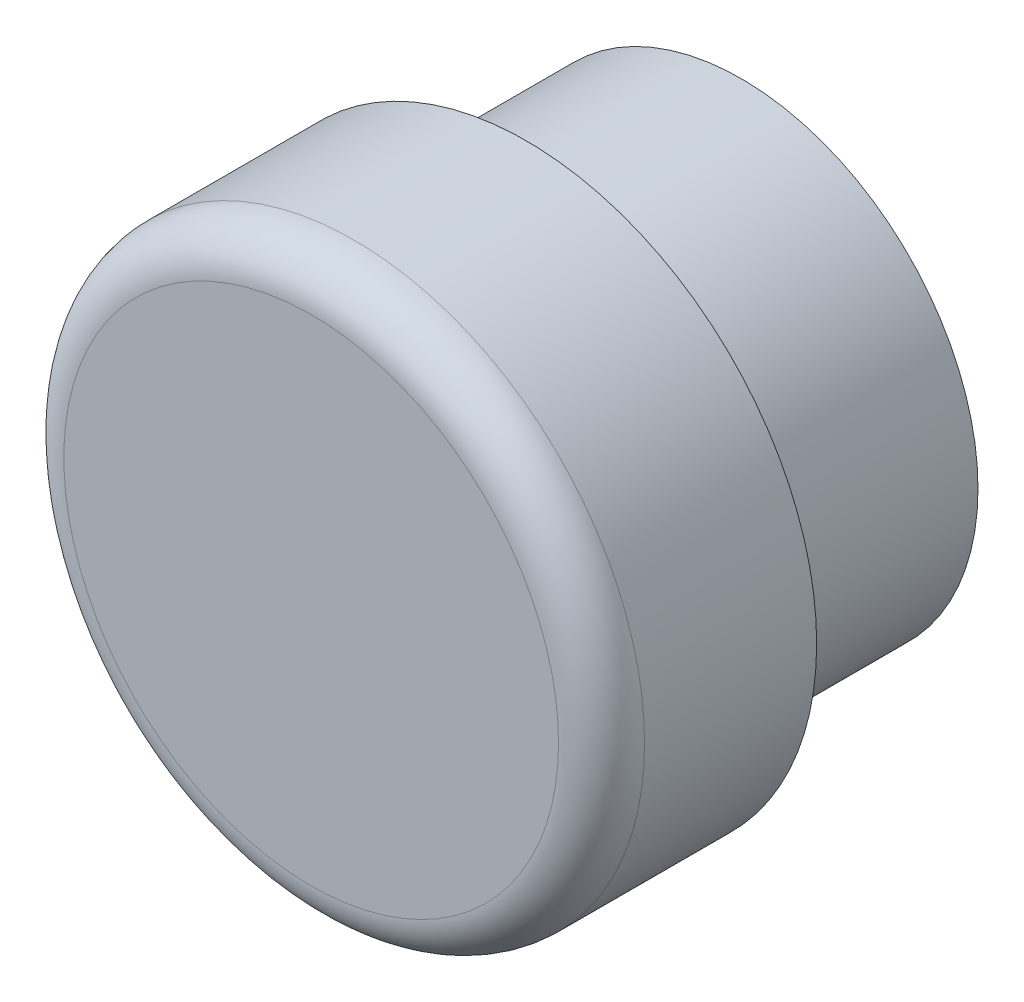
from build123d import *

# Parameters (mm, degrees)
SKETCH1_R           = 11
BOSS_EXTRUDE1_DEPTH = 10
SKETCH2_R           = 13.5
BOSS_EXTRUDE2_DEPTH = 10
FILLET1_R           = 2


with BuildPart() as part:
    # Sketch1 → Boss-Extrude1 (new body)
    with BuildSketch(Plane.XY):
        Circle(SKETCH1_R)
    extrude(amount=BOSS_EXTRUDE1_DEPTH)

    # Sketch2 → Boss-Extrude2 (add)
    with BuildSketch(Plane.XY.offset(10)):
        Circle(SKETCH2_R)
    extrude(amount=BOSS_EXTRUDE2_DEPTH)

    # Fillet1
    fillet1_edges = [part.edges().sort_by_distance(p)[0] for p in [
        (-13.5, 0, 20),
    ]]
    fillet(fillet1_edges, radius=FILLET1_R)


solid = part.part
